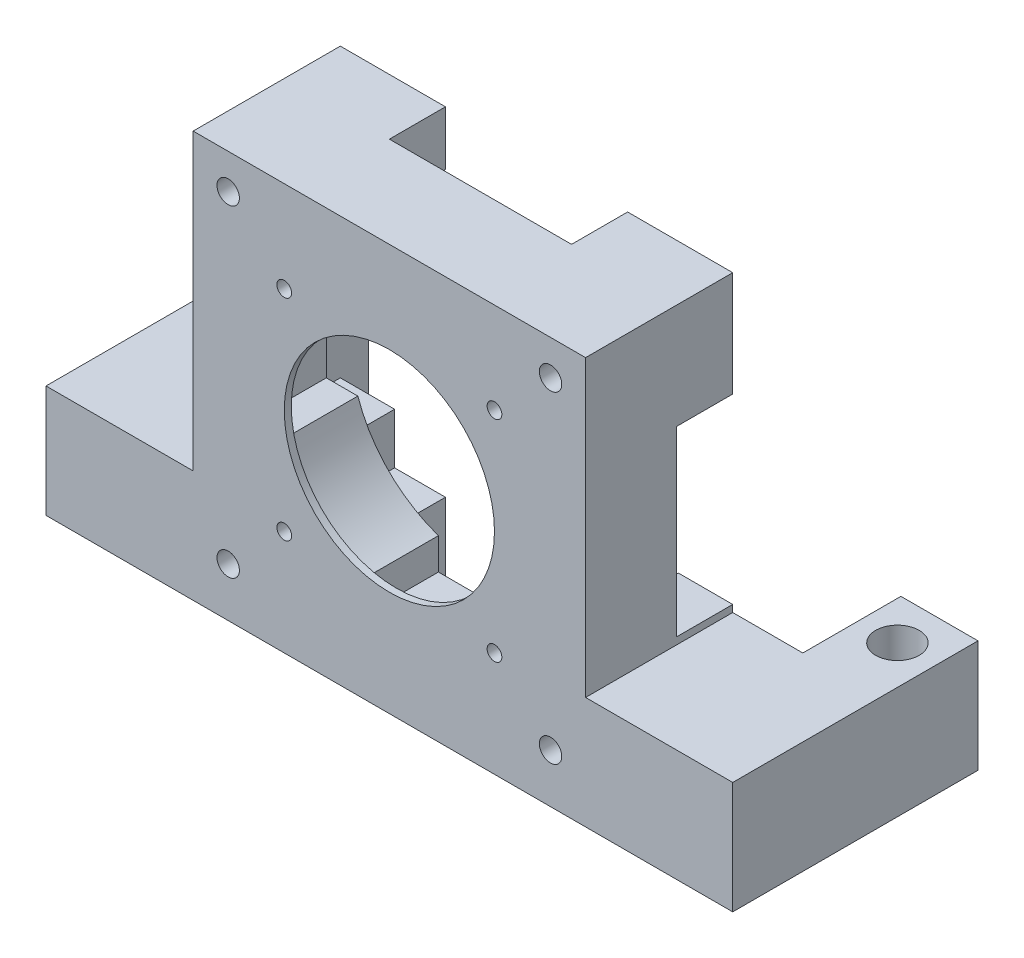
from build123d import *

# Parameters (mm, degrees)
BOSS_EXTRUDE1_DEPTH      = 13
BOSS_EXTRUDE1_DEPTH_BACK = 8
SKETCH2_W                = 56
SKETCH2_H                = 56
CUT_EXTRUDE1_DEPTH       = 12
CUT_EXTRUDE1_DEPTH_BACK  = 42.677331968
SKETCH1_R                = 18.5
SKETCH4_R                = 15
CUT_EXTRUDE2_DEPTH       = 42.677331968
CUT_EXTRUDE3_START       = -42.677331968
SKETCH5_W                = 12
SKETCH5_H                = 8
CUT_EXTRUDE3_DEPTH       = 54.677331968
SKETCH6_W                = 40.5
SKETCH6_H                = 40.5
CUT_EXTRUDE4_DEPTH       = 42.677331968
SKETCH3_R                = 1.05
CUT_EXTRUDE5_DEPTH       = 42.677331968
CIRPATTERN1_COUNT        = 4
SKETCH7_W                = 98
SKETCH7_H                = 21
BOSS_EXTRUDE2_DEPTH      = 2
BOSS_EXTRUDE3_DEPTH      = 16
SKETCH9_R                = 3.1
CUT_EXTRUDE6_DEPTH       = 69.183575735
SKETCH10_W               = 26
SKETCH10_H               = 9.75
CUT_EXTRUDE7_DEPTH       = 62.522353661
SKETCH11_R               = 1.6
CUT_EXTRUDE8_DEPTH       = 62.171888969
MIRROR4_COPY_1_SKETCH_R  = 1.6
MIRROR4_COPY_1_DEPTH     = 62.171888969
CIRPATTERN2_COUNT        = 4
CIRPATTERN3_COUNT        = 4


with BuildPart() as part:
    # Sketch2 → Boss-Extrude1 (new, two sides: drawn at the far end of the back side and taken through both)
    with BuildSketch(Plane.XY.offset(-BOSS_EXTRUDE1_DEPTH_BACK)):
        Rectangle(SKETCH2_W, SKETCH2_H)
    extrude(amount=BOSS_EXTRUDE1_DEPTH + BOSS_EXTRUDE1_DEPTH_BACK)

    # Sketch1 → Cut-Extrude1 (cut, two sides: drawn at the far end of the back side and taken through both)
    with BuildSketch(Plane.XY.offset(-CUT_EXTRUDE1_DEPTH_BACK)):
        Circle(SKETCH1_R)
    extrude(amount=CUT_EXTRUDE1_DEPTH + CUT_EXTRUDE1_DEPTH_BACK, mode=Mode.SUBTRACT)

    # Sketch4 → Cut-Extrude2 (cut, through all)
    with BuildSketch(Plane.XY):
        with Locations(Location((0, 0, 0), (0, 0, 180))):
            Circle(SKETCH4_R)
    extrude(amount=CUT_EXTRUDE2_DEPTH, mode=Mode.SUBTRACT)

    # Sketch5 → Cut-Extrude3 (cut)
    with BuildSketch(Plane.XY.offset(CUT_EXTRUDE3_START)):
        with Locations((0, 18)):
            Rectangle(SKETCH5_W, SKETCH5_H)
    cut_extrude3 = extrude(amount=CUT_EXTRUDE3_DEPTH, mode=Mode.SUBTRACT)

    # Sketch6 → Cut-Extrude4 (cut, through all)
    with BuildSketch(Plane.XY):
        Rectangle(SKETCH6_W, SKETCH6_H)
    extrude(amount=-CUT_EXTRUDE4_DEPTH, mode=Mode.SUBTRACT)

    # Sketch3 → Cut-Extrude5 (cut, symmetric)
    with BuildSketch(Plane.XY):
        with Locations((15, 15)):
            Circle(SKETCH3_R)
    cut_extrude5 = extrude(amount=CUT_EXTRUDE5_DEPTH, both=True, mode=Mode.SUBTRACT)

    # CirPattern1: Cut-Extrude5 ×4 about axis
    cirpattern1_axis = Axis((0, 0, 0), (0, 0, 1))
    for i in range(1, CIRPATTERN1_COUNT):
        add(cut_extrude5.rotate(cirpattern1_axis, i * 360 / CIRPATTERN1_COUNT), mode=Mode.SUBTRACT)

    # Sketch7 → Boss-Extrude2 (add)
    with BuildSketch(Plane.XZ.offset(28)):
        with Locations((0, 2.5)):
            Rectangle(SKETCH7_W, SKETCH7_H)
    extrude(amount=BOSS_EXTRUDE2_DEPTH)

    # Sketch8 → Boss-Extrude3 (add)
    with BuildSketch(Plane.XZ.offset(30)):
        Polygon((49, 13), (39, 13), (28, 13), (28, -8), (38, -8), (38, -22), (49, -22), align=None)
    boss_extrude3 = extrude(amount=-BOSS_EXTRUDE3_DEPTH)

    # Mirror1: Boss-Extrude3 across plane
    add(boss_extrude3.mirror(Plane(origin=(0, 0, 0), x_dir=(0, 0, 1), z_dir=(1, 0, 0))))

    # Sketch9 → Cut-Extrude6 (cut, through all)
    with BuildSketch(Plane(origin=(0, -14, 0), x_dir=(1, 0, 0), z_dir=(0, 1, 0))):
        with Locations(Location((-43.5, 16, 0), (0, 0, 270))):
            Circle(SKETCH9_R)
    cut_extrude6 = extrude(amount=-CUT_EXTRUDE6_DEPTH, mode=Mode.SUBTRACT)

    # Mirror2: Cut-Extrude6 across plane
    add(cut_extrude6.mirror(Plane(origin=(0, 0, 0), x_dir=(0, 0, 1), z_dir=(1, 0, 0))), mode=Mode.SUBTRACT)

    # Sketch10 → Cut-Extrude7 (cut, through all)
    with BuildSketch(Plane(origin=(0, 0, 0), x_dir=(-1, 0, 0), z_dir=(0, 0, -1))):
        with Locations((0, -25.125)):
            Rectangle(SKETCH10_W, SKETCH10_H)
    cut_extrude7 = extrude(amount=CUT_EXTRUDE7_DEPTH, mode=Mode.SUBTRACT)

    # Sketch11 → Cut-Extrude8 (cut, through all)
    with BuildSketch(Plane(origin=(0, 0, -8), x_dir=(-1, 0, 0), z_dir=(0, 0, -1))):
        with Locations((-23, 23)):
            Circle(SKETCH11_R)
    cut_extrude8 = extrude(amount=-CUT_EXTRUDE8_DEPTH, mode=Mode.SUBTRACT)

    # Mirror3: Cut-Extrude8 across plane
    add(cut_extrude8.mirror(Plane.ZX), mode=Mode.SUBTRACT)

    # Mirror4: Cut-Extrude8 across plane
    add(cut_extrude8.mirror(Plane(origin=(0, 0, 0), x_dir=(0, 0, 1), z_dir=(1, 0, 0))), mode=Mode.SUBTRACT)

    # Mirror4 copy 1 sketch → Mirror4 copy 1 (cut, through all)
    with BuildSketch(Plane(origin=(0, 0, -8), x_dir=(1, 0, 0), z_dir=(0, 0, -1))):
        with Locations((-23, 23)):
            Circle(MIRROR4_COPY_1_SKETCH_R)
    extrude(amount=-MIRROR4_COPY_1_DEPTH, mode=Mode.SUBTRACT)

    # CirPattern2: Cut-Extrude3 ×4 about axis
    cirpattern2_axis = Axis((0, 0, 0), (0, 0, 1))
    for i in range(1, CIRPATTERN2_COUNT):
        add(cut_extrude3.rotate(cirpattern2_axis, i * 360 / CIRPATTERN2_COUNT), mode=Mode.SUBTRACT)

    # CirPattern3: Cut-Extrude7 ×4 about axis
    cirpattern3_axis = Axis((0, 0, 0), (0, 0, 1))
    for i in range(1, CIRPATTERN3_COUNT):
        add(cut_extrude7.rotate(cirpattern3_axis, i * 360 / CIRPATTERN3_COUNT), mode=Mode.SUBTRACT)


solid = part.part
